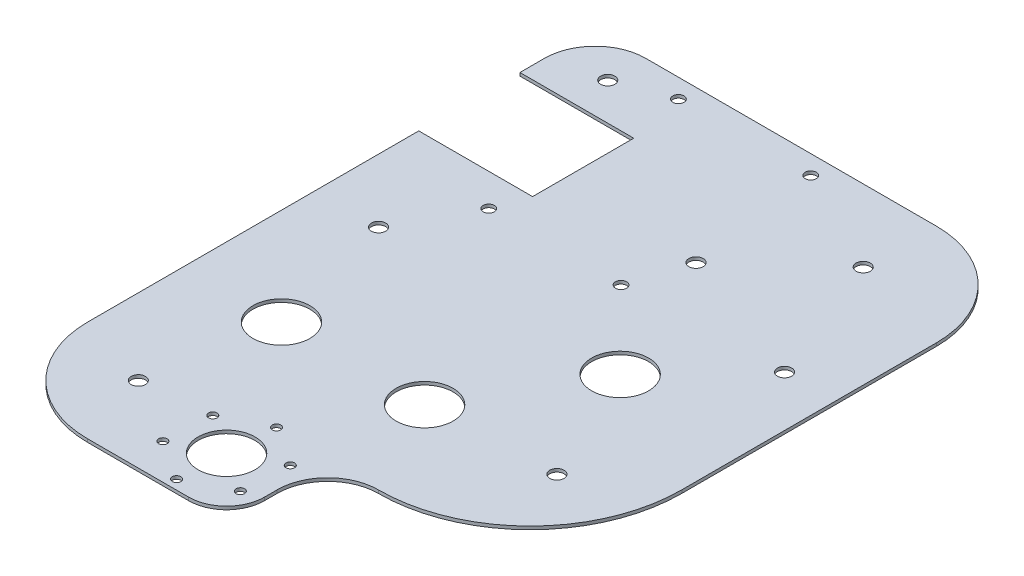
from build123d import *

# Parameters (mm, degrees)
SKETCH1_W               = 222.123
SKETCH1_H               = 254.783638074
SKETCH1_R               = 14.2875
BOSS_EXTRUDE1_DEPTH     = 1.5875
SKETCH4_R               = 2.8067
CUT_EXTRUDE1_DEPTH      = 170.014355888
SKETCH5_R               = 1.5875
CUT_EXTRUDE2_DEPTH      = 170.014355888
SKETCH6_W               = 222.123
SKETCH6_H               = 1.5875
BOSS_EXTRUDE2_DEPTH     = 50.8
SKETCH7_W               = 101.6
SKETCH7_H               = 50.8
CUT_EXTRUDE3_DEPTH      = 210.975001632
SKETCH8_R               = 14.2875
CUT_EXTRUDE5_DEPTH      = 210.975001632
SKETCH9_R               = 2.15
CUT_EXTRUDE6_DEPTH      = 210.975001632
SKETCH10_W              = 57.15
SKETCH10_H              = 50.8
CUT_EXTRUDE7_DEPTH      = 210.975001632
CUT_EXTRUDE8_DEPTH      = 210.975001632
FILLET2_R               = 25.4
CUT_EXTRUDE9_DEPTH      = 210.975001632
CUT_EXTRUDE10_DEPTH     = 210.975001632
CUT_EXTRUDE11_DEPTH     = 210.975001632
CUT_EXTRUDE12_DEPTH     = 210.975001632
SKETCH16_R              = 1.27
CUT_EXTRUDE13_DEPTH     = 210.975001632
F_1_4_CLEARANCE_HOLE1_D = 7.14248


with BuildPart() as part:
    # Sketch1 → Boss-Extrude1 (new body)
    with BuildSketch(Plane(origin=(0, 0, 0), x_dir=(1, 0, 0), z_dir=(0, 1, 0))):
        Rectangle(SKETCH1_W, SKETCH1_H)
        with Locations(Location((9.4615, -78.750819037, 0), (0, 0, 270))):
            Circle(SKETCH1_R, mode=Mode.SUBTRACT)
        with Locations(Location((45.4025, -16.499180963, 0), (0, 0, 270))):
            Circle(SKETCH1_R, mode=Mode.SUBTRACT)
        with Locations(Location((-62.4205, -78.750819037, 0), (0, 0, 270))):
            Circle(SKETCH1_R, mode=Mode.SUBTRACT)
    extrude(amount=BOSS_EXTRUDE1_DEPTH)

    # Sketch4 → Cut-Extrude1 (cut, through all)
    with BuildSketch(Plane(origin=(0, 0, 0), x_dir=(-1, 0, 0), z_dir=(0, -1, 0))):
        with Locations(Location((59.692539866, 117.866819037, 0), (0, 0, 90))):
            Circle(SKETCH4_R)
        with Locations(Location((59.692539866, 22.616819037, 0), (0, 0, 90))):
            Circle(SKETCH4_R)
        with Locations(Location((-6.733539866, 117.866819037, 0), (0, 0, 90))):
            Circle(SKETCH4_R)
        with Locations(Location((-6.733539866, 22.616819037, 0), (0, 0, 90))):
            Circle(SKETCH4_R)
    extrude(amount=-CUT_EXTRUDE1_DEPTH, mode=Mode.SUBTRACT)

    # Sketch5 → Cut-Extrude2 (cut, through all)
    with BuildSketch(Plane.XZ):
        with Locations(Location((59.770116522, -91.195174152, 0), (0, 0, 270))):
            Circle(SKETCH5_R)
    extrude(amount=-CUT_EXTRUDE2_DEPTH, mode=Mode.SUBTRACT)

    # Sketch6 → Boss-Extrude2 (add)
    with BuildSketch(Plane.XY.offset(127.391819037)):
        with Locations((0, 0.79375)):
            Rectangle(SKETCH6_W, SKETCH6_H)
    extrude(amount=BOSS_EXTRUDE2_DEPTH)

    # Sketch7 → Cut-Extrude3 (cut, through all)
    with BuildSketch(Plane(origin=(0, 0, 0), x_dir=(-1, 0, 0), z_dir=(0, -1, 0))):
        with Locations((-60.2615, -152.791819037)):
            Rectangle(SKETCH7_W, SKETCH7_H)
    extrude(amount=-CUT_EXTRUDE3_DEPTH, mode=Mode.SUBTRACT)

    # Sketch8 → Cut-Extrude5 (cut, through all)
    with BuildSketch(Plane(origin=(0, 1.5875, 0), x_dir=(1, 0, 0), z_dir=(0, 1, 0))):
        with Locations(Location((-19.1135, -149.616819037, 0), (0, 0, 270))):
            Circle(SKETCH8_R)
    extrude(amount=-CUT_EXTRUDE5_DEPTH, mode=Mode.SUBTRACT)

    # Sketch9 → Cut-Extrude6 (cut, through all)
    with BuildSketch(Plane(origin=(0, 1.5875, 0), x_dir=(1, 0, 0), z_dir=(0, 1, 0))):
        with Locations(Location((-17.801836865, -125.840471629, 0), (0, 0, 270))):
            Circle(SKETCH9_R)
        with Locations(Location((2.133252432, -138.86457893, 0), (0, 0, 270))):
            Circle(SKETCH9_R)
        with Locations(Location((0.821589297, -162.640926338, 0), (0, 0, 270))):
            Circle(SKETCH9_R)
        with Locations(Location((-20.425163135, -173.393166445, 0), (0, 0, 270))):
            Circle(SKETCH9_R)
        with Locations(Location((-40.360252432, -160.369059145, 0), (0, 0, 270))):
            Circle(SKETCH9_R)
        with Locations(Location((-39.048589297, -136.592711737, 0), (0, 0, 270))):
            Circle(SKETCH9_R)
    extrude(amount=-CUT_EXTRUDE6_DEPTH, mode=Mode.SUBTRACT)

    # Sketch10 → Cut-Extrude7 (cut, through all)
    with BuildSketch(Plane(origin=(0, 1.5875, 0), x_dir=(1, 0, 0), z_dir=(0, 1, 0))):
        with Locations((-82.4865, 64.242728021)):
            Rectangle(SKETCH10_W, SKETCH10_H)
    extrude(amount=-CUT_EXTRUDE7_DEPTH, mode=Mode.SUBTRACT)

    # Sketch11 → Cut-Extrude8 (cut, through all)
    with BuildSketch(Plane(origin=(0, 1.5875, 0), x_dir=(1, 0, 0), z_dir=(0, 1, 0))):
        with BuildLine():
            Line((-9.5885, -178.191819037), (9.4615, -178.191819037))
            Line((9.4615, -178.191819037), (9.4615, -159.141819037))
            ThreePointArc((9.4615, -159.141819037), (3.881884182, -172.612203219), (-9.5885, -178.191819037))
        make_face()
    extrude(amount=-CUT_EXTRUDE8_DEPTH, mode=Mode.SUBTRACT)

    # Fillet2
    fillet2_edges = [part.edges().sort_by_distance(p)[0] for p in [
        (9.4615, 0.79375, 127.391819037),
    ]]
    fillet(fillet2_edges, radius=FILLET2_R)

    # Sketch12 → Cut-Extrude9 (cut, through all)
    with BuildSketch(Plane(origin=(0, 1.5875, 0), x_dir=(1, 0, 0), z_dir=(0, 1, 0))):
        with BuildLine():
            Line((111.0615, -51.191819037), (111.0615, -127.391819037))
            Line((111.0615, -127.391819037), (34.8615, -127.391819037))
            ThreePointArc((34.8615, -127.391819037), (88.743036726, -105.073355764), (111.0615, -51.191819037))
        make_face()
    extrude(amount=-CUT_EXTRUDE9_DEPTH, mode=Mode.SUBTRACT)

    # Sketch13 → Cut-Extrude10 (cut, through all)
    with BuildSketch(Plane(origin=(0, 1.5875, 0), x_dir=(1, 0, 0), z_dir=(0, 1, 0))):
        with BuildLine():
            Line((60.2615, 127.391819037), (111.0615, 127.391819037))
            Line((111.0615, 127.391819037), (111.0615, 76.591819037))
            ThreePointArc((111.0615, 76.591819037), (96.182524484, 112.512843522), (60.2615, 127.391819037))
        make_face()
    extrude(amount=-CUT_EXTRUDE10_DEPTH, mode=Mode.SUBTRACT)

    # Sketch14 → Cut-Extrude11 (cut, through all)
    with BuildSketch(Plane(origin=(0, 1.5875, 0), x_dir=(1, 0, 0), z_dir=(0, 1, 0))):
        with BuildLine():
            Line((-85.6615, 127.391819037), (-111.0615, 127.391819037))
            Line((-111.0615, 127.391819037), (-111.0615, 101.991819037))
            ThreePointArc((-111.0615, 101.991819037), (-103.622012242, 119.95233128), (-85.6615, 127.391819037))
        make_face()
    extrude(amount=-CUT_EXTRUDE11_DEPTH, mode=Mode.SUBTRACT)

    # Sketch15 → Cut-Extrude12 (cut, through all)
    with BuildSketch(Plane(origin=(0, 1.5875, 0), x_dir=(1, 0, 0), z_dir=(0, 1, 0))):
        with BuildLine():
            Line((-111.0615, -127.391819037), (-111.0615, -178.191819037))
            Line((-111.0615, -178.191819037), (-60.2615, -178.191819037))
            ThreePointArc((-60.2615, -178.191819037), (-96.182524484, -163.312843522), (-111.0615, -127.391819037))
        make_face()
    extrude(amount=-CUT_EXTRUDE12_DEPTH, mode=Mode.SUBTRACT)

    # Sketch16 → Cut-Extrude13 (cut, through all)
    with BuildSketch(Plane.XZ):
        with Locations(Location((-85.6615, -108.341819037, 0), (0, 0, 270))):
            Circle(SKETCH16_R)
        with Locations(Location((-79.3115, 13.091819037, 0), (0, 0, 270))):
            Circle(SKETCH16_R)
        with Locations(Location((-72.9615, 140.091819037, 0), (0, 0, 270))):
            Circle(SKETCH16_R)
        with Locations(Location((72.9615, 75.808180963, 0), (0, 0, 270))):
            Circle(SKETCH16_R)
        with Locations(Location((85.6615, -25.791819037, 0), (0, 0, 270))):
            Circle(SKETCH16_R)
        with Locations(Location((15.8115, -51.191819037, 0), (0, 0, 270))):
            Circle(SKETCH16_R)
    extrude(amount=-CUT_EXTRUDE13_DEPTH, mode=Mode.SUBTRACT)

    # 1/4 Clearance Hole1 (through all)
    with Locations(Plane(origin=(0, 1.5875, 0), x_dir=(1, 0, 0), z_dir=(0, 1, 0))):
        with Locations((-85.6615, 108.341819037), (-79.3115, -13.091819037), (-72.9615, -140.091819037), (72.9615, -75.808180963), (85.6615, 25.791819037), (59.770116522, 91.195174152), (15.8115, 51.191819037)):
            Hole(F_1_4_CLEARANCE_HOLE1_D / 2)


solid = part.part
